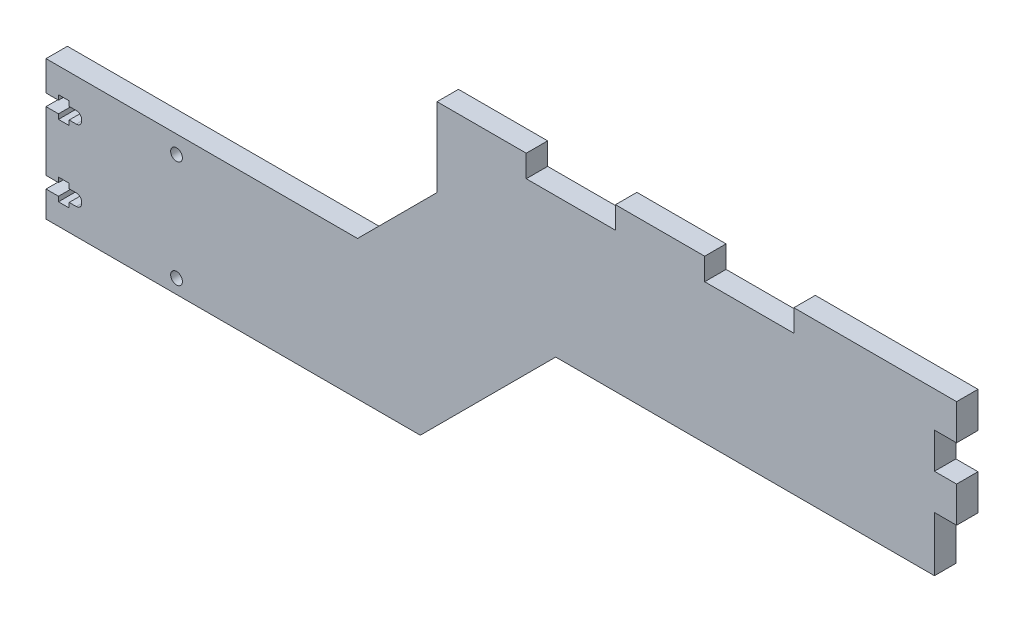
from build123d import *

# Parameters (mm, degrees)
EXTRUDE_1_DEPTH     = 6
SKETCH_2_R          = 1.65
CUT_EXTRUDE_1_DEPTH = 171.71260254


with BuildPart() as part:
    # Эскиз1 → Бобышка-Вытянуть1 (new body)
    with BuildSketch(Plane.XY):
        Polygon((-164.468308742, 1.015256317), (-164.468308742, -37.946418867), (-59.578582118, -37.946418867), (-21.632163251, 0), (84.510530021, 0), (84.510530021, 15.353810043), (90.710530021, 15.353810043), (90.710530021, 25.353810043), (84.510530021, 25.353810043), (84.510530021, 35.353810043), (90.710530021, 35.353810043), (90.710530021, 45.353810043), (45.113947205, 45.353810043), (45.113947205, 39.153810043), (20.113947205, 39.153810043), (20.113947205, 45.353810043), (-4.886052795, 45.353810043), (-4.886052795, 39.153810043), (-29.886052795, 39.153810043), (-29.886052795, 45.353810043), (-54.886052795, 45.353810043), (-54.886052795, 23.298924803), (-77.169721281, 1.015256317), align=None)
    extrude(amount=EXTRUDE_1_DEPTH)

    # Эскиз2 → Вырез-Вытянуть1 (cut, through all)
    with BuildSketch(Plane.XY.offset(6)):
        with Locations((-127.888308742, -3.984743683)):
            Circle(SKETCH_2_R)
        with Locations((-127.888308742, -33.984743683)):
            Circle(SKETCH_2_R)
        with BuildLine():
            Line((-157.968308742, -10.634743683), (-157.968308742, -11.984743683))
            Line((-157.968308742, -11.984743683), (-160.968308742, -11.984743683))
            Line((-160.968308742, -11.984743683), (-160.968308742, -10.634743683))
            Line((-160.968308742, -10.634743683), (-164.468308742, -10.634743683))
            Line((-164.468308742, -10.634743683), (-164.468308742, -7.334743683))
            Line((-164.468308742, -7.334743683), (-160.968308742, -7.334743683))
            Line((-160.968308742, -7.334743683), (-160.968308742, -5.984743683))
            Line((-160.968308742, -5.984743683), (-157.968308742, -5.984743683))
            Line((-157.968308742, -5.984743683), (-157.968308742, -7.334743683))
            Line((-157.968308742, -7.334743683), (-155.968308742, -7.334743683))
            ThreePointArc((-155.968308742, -7.334743683), (-154.90764857, -7.774083512), (-154.468308742, -8.834743683))
            Line((-154.468308742, -8.834743683), (-154.468308742, -9.134743683))
            ThreePointArc((-154.468308742, -9.134743683), (-154.90764857, -10.195403855), (-155.968308742, -10.634743683))
            Line((-155.968308742, -10.634743683), (-157.968308742, -10.634743683))
        make_face()
        with BuildLine():
            Line((-160.968308742, -25.984743683), (-157.968308742, -25.984743683))
            Line((-157.968308742, -25.984743683), (-157.968308742, -27.334743683))
            Line((-157.968308742, -27.334743683), (-155.968308742, -27.334743683))
            ThreePointArc((-155.968308742, -27.334743683), (-154.90764857, -27.774083512), (-154.468308742, -28.834743683))
            Line((-154.468308742, -28.834743683), (-154.468308742, -29.134743683))
            ThreePointArc((-154.468308742, -29.134743683), (-154.90764857, -30.195403855), (-155.968308742, -30.634743683))
            Line((-155.968308742, -30.634743683), (-157.968308742, -30.634743683))
            Line((-157.968308742, -30.634743683), (-157.968308742, -31.984743683))
            Line((-157.968308742, -31.984743683), (-160.968308742, -31.984743683))
            Line((-160.968308742, -31.984743683), (-160.968308742, -30.634743683))
            Line((-160.968308742, -30.634743683), (-164.468308742, -30.634743683))
            Line((-164.468308742, -30.634743683), (-164.468308742, -27.334743683))
            Line((-164.468308742, -27.334743683), (-160.968308742, -27.334743683))
            Line((-160.968308742, -27.334743683), (-160.968308742, -25.984743683))
        make_face()
    extrude(amount=-CUT_EXTRUDE_1_DEPTH, mode=Mode.SUBTRACT)


solid = part.part
